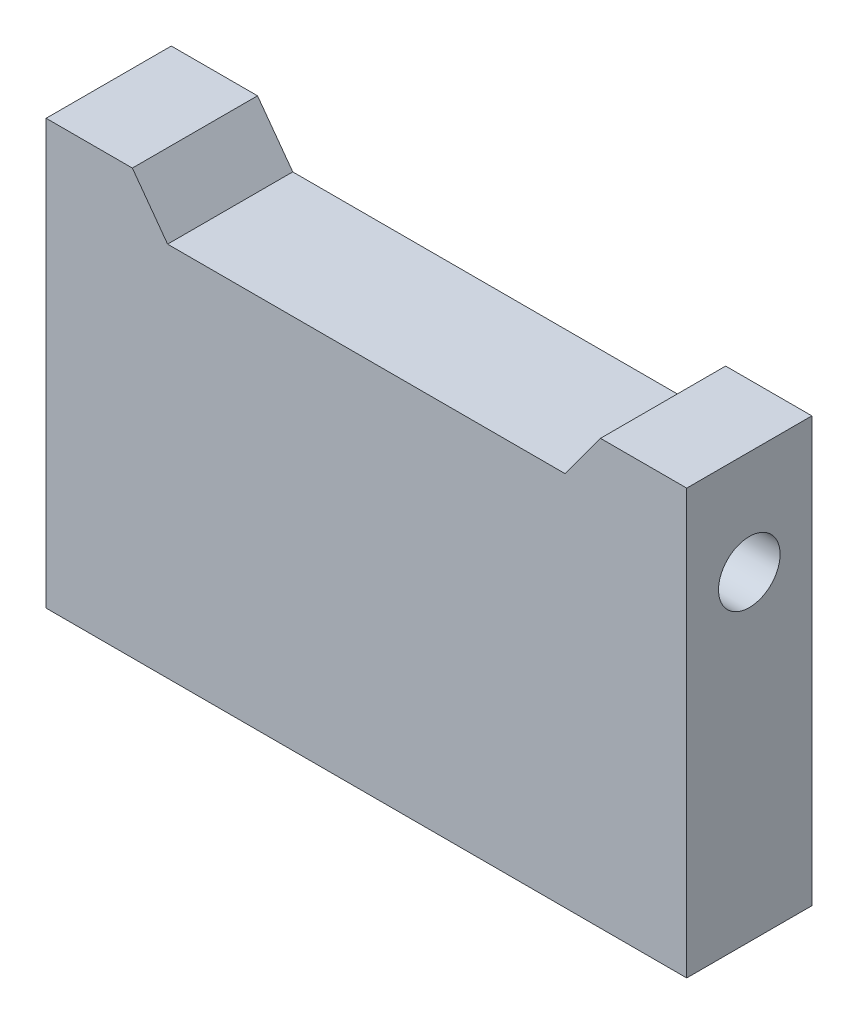
from build123d import *

# Parameters (mm, degrees)
SCHIZZO1_W                    = 26
SCHIZZO1_H                    = 17.22
ESTRUSIONE_ESTRUSIONE1_DEPTH  = 5.08
TAGLIO_ESTRUSIONE1_DEPTH      = 17.399344499
FORO_FILETTATO_M3X0_5_1_D     = 2.5
FORO_FILETTATO_M3X0_5_1_DEPTH = 8
FORO_FILETTATO_M3X0_5_1_TIP   = 0.751075774


with BuildPart() as part:
    # Schizzo1 → Estrusione-Estrusione1 (new body)
    with BuildSketch(Plane.XY):
        Rectangle(SCHIZZO1_W, SCHIZZO1_H)
    extrude(amount=-ESTRUSIONE_ESTRUSIONE1_DEPTH)

    # Schizzo2 → Taglio-Estrusione1 (cut, through all)
    with BuildSketch(Plane.XY):
        Polygon((-9.5, 8.61), (9.5, 8.61), (8.07, 6.65), (-8.07, 6.65), align=None)
    extrude(amount=-TAGLIO_ESTRUSIONE1_DEPTH, mode=Mode.SUBTRACT)

    # Foro filettato M3x0.5-1
    with Locations(Plane(origin=(0, -8.61, 0), x_dir=(-1, 0, 0), z_dir=(0, -1, 0))):
        with Locations((10, 2.54), (-10, 2.54)):
            Hole(FORO_FILETTATO_M3X0_5_1_D / 2, depth=FORO_FILETTATO_M3X0_5_1_DEPTH)
            with Locations((0, 0, -(FORO_FILETTATO_M3X0_5_1_DEPTH + FORO_FILETTATO_M3X0_5_1_TIP / 2))):  # 118° drill point
                Cone(0, FORO_FILETTATO_M3X0_5_1_D / 2, FORO_FILETTATO_M3X0_5_1_TIP, mode=Mode.SUBTRACT)

    # Schizzo5 → Foro filettato M3x0.5-2 (revolve, cut)
    with BuildSketch(Plane(origin=(-13, 4.39, -2.54), x_dir=(0, 0, 1), z_dir=(0, 1, 0))):
        Polygon((0, 0), (0, 6.751075774), (1.25, 6), (1.25, 0), align=None)
    foro_filettato_m3x0_5_2 = revolve(axis=Axis((-19.35, 4.39, -2.54), (1, 0, 0)), mode=Mode.SUBTRACT)

    # Specchia1: Foro filettato M3x0.5-2 across plane
    add(foro_filettato_m3x0_5_2.mirror(Plane(origin=(0, 0, 0), x_dir=(0, 0, 1), z_dir=(1, 0, 0))), mode=Mode.SUBTRACT)


solid = part.part
